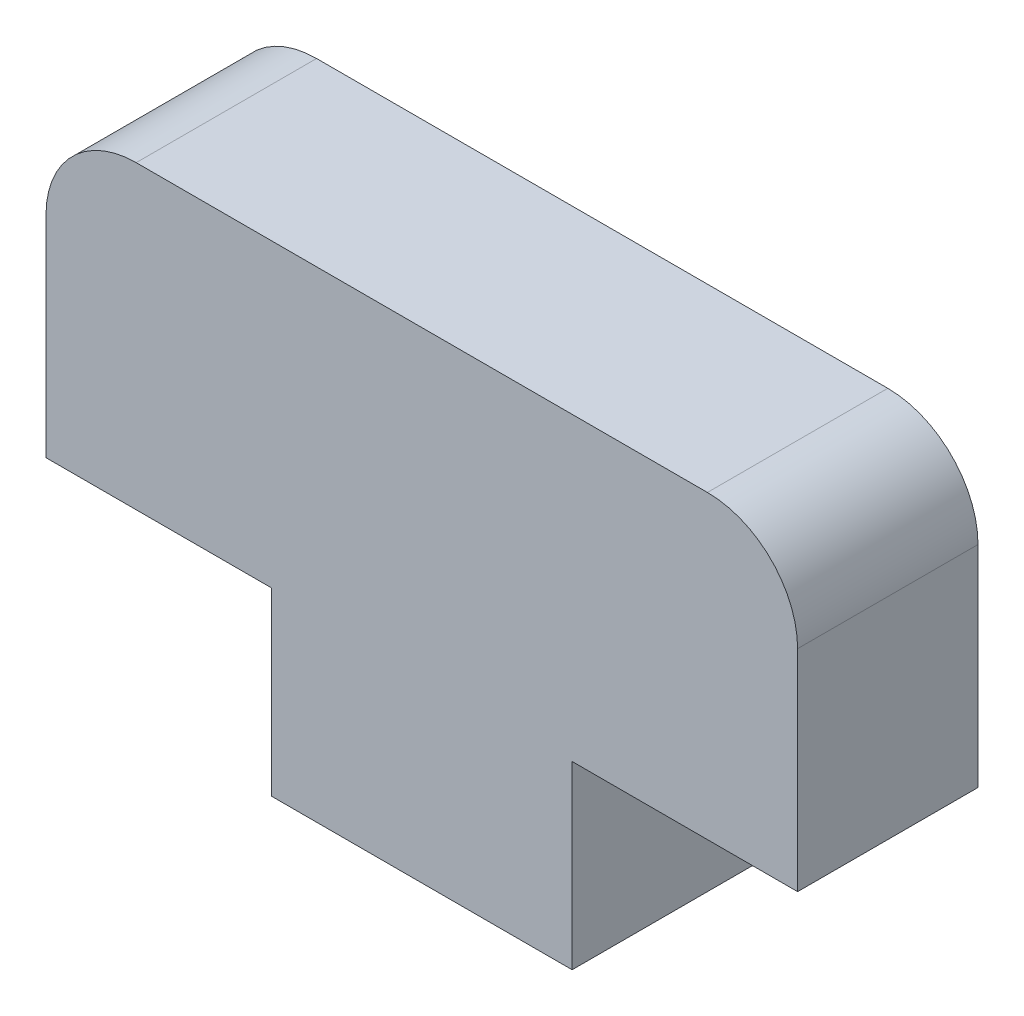
from build123d import *

# Parameters (mm, degrees)
BOSS_EXTRU_1_DEPTH = 6
CONG_1_R           = 3


with BuildPart() as part:
    # Esquisse1 → Boss.-Extru.1 (new body)
    with BuildSketch(Plane.XY):
        Polygon((5, -5), (12.5, -5), (12.5, 5), (-12.5, 5), (-12.5, -5), (-5, -5), (-5, -11), (5, -11), align=None)
    extrude(amount=BOSS_EXTRU_1_DEPTH)

    # Congé1
    cong_1_edges = [part.edges().sort_by_distance(p)[0] for p in [
        (-12.5, 5, 3),
        (12.5, 5, 3),
    ]]
    fillet(cong_1_edges, radius=CONG_1_R)


solid = part.part
